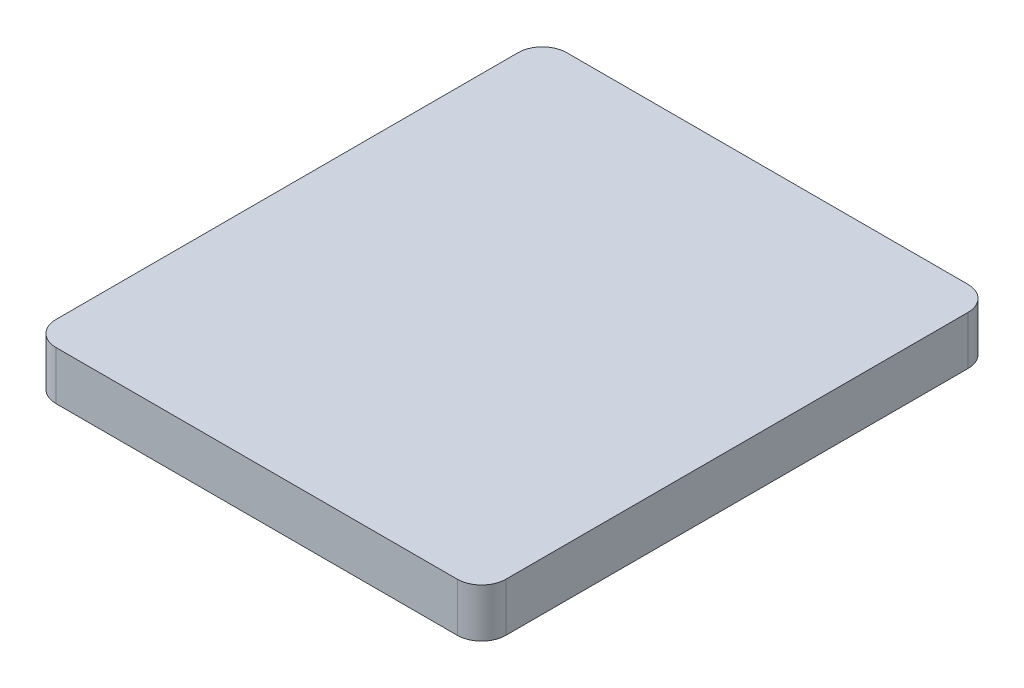
from build123d import *

# Parameters (mm, degrees)
SKETCH1_W           = 18.5
SKETCH1_H           = 21
BOSS_EXTRUDE1_DEPTH = 2
FILLET1_R           = 1


with BuildPart() as part:
    # Sketch1 → Boss-Extrude1 (new body)
    with BuildSketch(Plane(origin=(0, 0, 0), x_dir=(1, 0, 0), z_dir=(0, 1, 0))):
        with Locations((9.25, 10.5)):
            Rectangle(SKETCH1_W, SKETCH1_H)
    extrude(amount=BOSS_EXTRUDE1_DEPTH)

    # Fillet1
    fillet1_edges = [part.edges().sort_by_distance(p)[0] for p in [
        (0, 1, -21),
        (18.5, 1, -21),
        (18.5, 1, 0),
        (0, 1, 0),
    ]]
    fillet(fillet1_edges, radius=FILLET1_R)


solid = part.part
